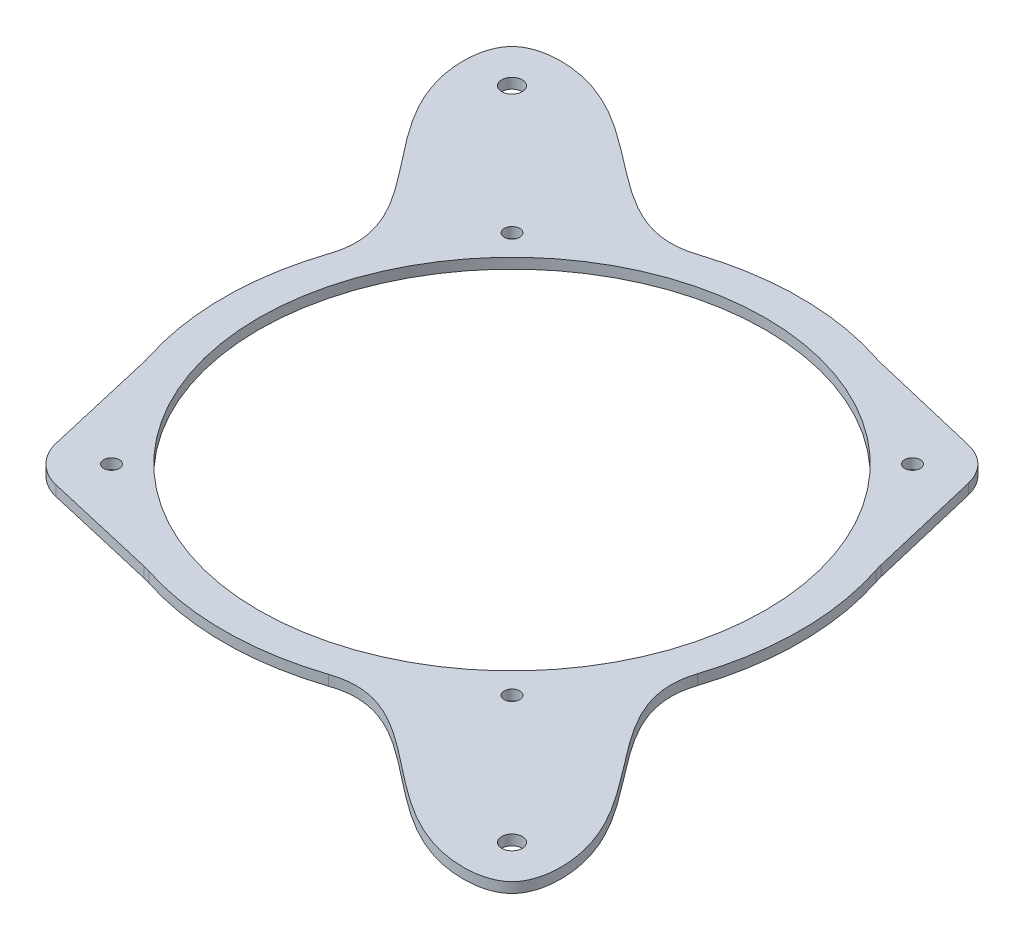
from build123d import *

# Parameters (mm, degrees)
SKETCH1_R           = 1.5
SKETCH1_R_2         = 2
SKETCH1_R_3         = 49.2
BOSS_EXTRUDE1_DEPTH = 2


with BuildPart() as part:
    # Sketch1 → Boss-Extrude1 (new body)
    with BuildSketch(Plane(origin=(0, 0, 0), x_dir=(1, 0, 0), z_dir=(0, 1, 0))):
        with BuildLine():
            Line((18.82031265, 52.821731984), (41.072517471, 47.543215273))
            ThreePointArc((41.072517471, 47.543215273), (43.317509083, 46.680398122), (45.253835365, 45.253835365))
            ThreePointArc((45.253835365, 45.253835365), (46.680398122, 43.317509083), (47.543215273, 41.072517471))
            Line((47.543215273, 41.072517471), (52.821731984, 18.82031265))
            ThreePointArc((52.821731984, 18.82031265), (52.992929389, 18.161367335), (53.192004456, 17.510301595))
            ThreePointArc((53.192004456, 17.510301595), (55.281581077, 8.941297091), (55.999797799, 0.150487493))
            ThreePointArc((55.999797799, 0.150487493), (55.328837954, -8.644055219), (53.285345919, -17.224166462))
            add(Edge.make_bspline(
                [(17.510301595, -53.192004456), (32.489465834, -48.006980162), (45.271303322, -74.663727089), (72.09559562, -72.088250151), (74.621611528, -45.282235757), (48.363407378, -32.139098611), (53.285345919, -17.224166462)],
                knots=[0, 0, 0, 0, 0.409378604, 0.499715911, 0.590053219, 1, 1, 1, 1], degree=3))
            ThreePointArc((17.510301595, -53.192004456), (0.150487493, -55.999797799), (-17.224166462, -53.285345919))
            ThreePointArc((-17.224166462, -53.285345919), (-17.876292734, -53.089772901), (-18.536148639, -52.922119493))
            Line((-18.536148639, -52.922119493), (-40.816401641, -47.763274249))
            ThreePointArc((-40.816401641, -47.763274249), (-43.21650894, -46.829307007), (-45.253835365, -45.253835365))
            ThreePointArc((-45.253835365, -45.253835365), (-46.829307007, -43.21650894), (-47.763274249, -40.816401641))
            Line((-47.763274249, -40.816401641), (-52.922119493, -18.536148639))
            ThreePointArc((-52.922119493, -18.536148639), (-53.089772901, -17.876292734), (-53.285345919, -17.224166462))
            ThreePointArc((-53.285345919, -17.224166462), (-55.999797799, 0.150487493), (-53.192004456, 17.510301595))
            add(Edge.make_bspline(
                [(-53.192004456, 17.510301595), (-48.006980162, 32.489465834), (-74.663727089, 45.271303322), (-72.088250151, 72.09559562), (-45.282235757, 74.621611528), (-32.139098612, 48.363407378), (-17.224166462, 53.285345919)],
                knots=[0, 0, 0, 0, 0.409378604, 0.499715911, 0.590053219, 1, 1, 1, 1], degree=3))
            ThreePointArc((-17.224166462, 53.285345919), (-8.644055219, 55.328837954), (0.150487493, 55.999797799))
            ThreePointArc((0.150487493, 55.999797799), (8.941297091, 55.281581077), (17.510301595, 53.192004456))
            ThreePointArc((17.510301595, 53.192004456), (18.161367335, 52.992929389), (18.82031265, 52.821731984))
        make_face()
        with Locations(Location((-38.8907, 38.8907, 0), (0, 0, 270))):
            Circle(SKETCH1_R, mode=Mode.SUBTRACT)
        with Locations(Location((38.8907, 38.8907, 0), (0, 0, 90))):
            Circle(SKETCH1_R, mode=Mode.SUBTRACT)
        with Locations(Location((38.8907, -38.8907, 0), (0, 0, 270))):
            Circle(SKETCH1_R, mode=Mode.SUBTRACT)
        with Locations(Location((-38.8907, -38.8907, 0), (0, 0, 90))):
            Circle(SKETCH1_R, mode=Mode.SUBTRACT)
        with Locations(Location((-63.639610307, 63.639610307, 0), (0, 0, 270))):
            Circle(SKETCH1_R_2, mode=Mode.SUBTRACT)
        with Locations(Location((63.639610307, -63.639610307, 0), (0, 0, 90))):
            Circle(SKETCH1_R_2, mode=Mode.SUBTRACT)
        with Locations(Location((0, 0, 0), (0, 0, 270))):
            Circle(SKETCH1_R_3, mode=Mode.SUBTRACT)
    extrude(amount=BOSS_EXTRUDE1_DEPTH)


solid = part.part
